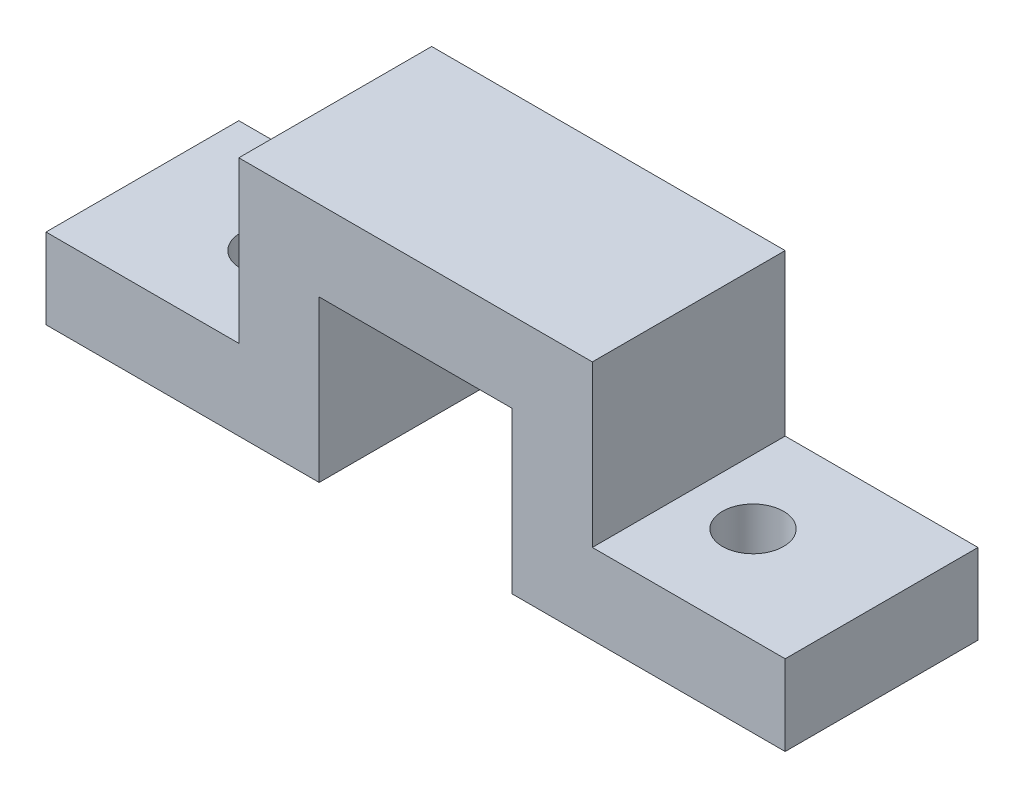
from build123d import *

# Parameters (mm, degrees)
EXTRUDE_1_DEPTH     = 12
SKETCH_2_R          = 1.9
CUT_EXTRUDE_5_DEPTH = 30.966648128


with BuildPart() as part:
    # 草图1 → 凸台-拉伸1 (new body)
    with BuildSketch(Plane.XY):
        Polygon((-11, 15), (11, 15), (11, 5), (23, 5), (23, 0), (6, 0), (6, 10), (-6, 10), (-6, 0), (-23, 0), (-23, 5), (-11, 5), align=None)
    extrude(amount=EXTRUDE_1_DEPTH)

    # 草图2 → 切除-拉伸5 (cut, through all)
    with BuildSketch(Plane(origin=(0, 0, 0), x_dir=(1, 0, 0), z_dir=(0, 1, 0))):
        with Locations((-15, -6)):
            Circle(SKETCH_2_R)
        with Locations(Location((15, -6, 0), (0, 0, 90))):
            Circle(SKETCH_2_R)
    extrude(amount=CUT_EXTRUDE_5_DEPTH, mode=Mode.SUBTRACT)


solid = part.part
